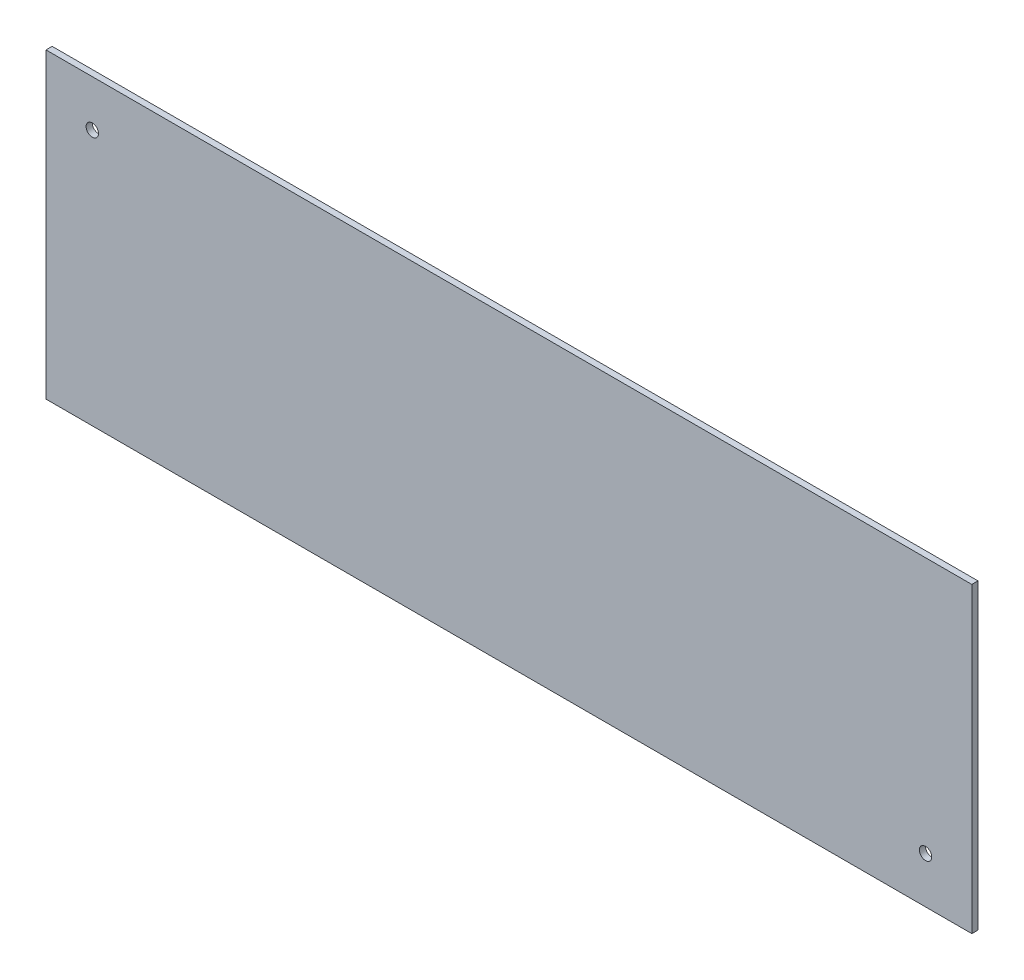
from build123d import *

# Parameters (mm, degrees)
SKETCH1_W           = 300
SKETCH1_H           = 98
BOSS_EXTRUDE1_DEPTH = 2
SKETCH2_R           = 2
CUT_EXTRUDE1_DEPTH  = 158.813180692


with BuildPart() as part:
    # Sketch1 → Boss-Extrude1 (new body)
    with BuildSketch(Plane.XY):
        Rectangle(SKETCH1_W, SKETCH1_H)
    extrude(amount=BOSS_EXTRUDE1_DEPTH)

    # Sketch2 → Cut-Extrude1 (cut, through all)
    with BuildSketch(Plane.XY.offset(2)):
        with Locations((-135, 34)):
            Circle(SKETCH2_R)
        with Locations((135, -34)):
            Circle(SKETCH2_R)
    extrude(amount=-CUT_EXTRUDE1_DEPTH, mode=Mode.SUBTRACT)


solid = part.part
